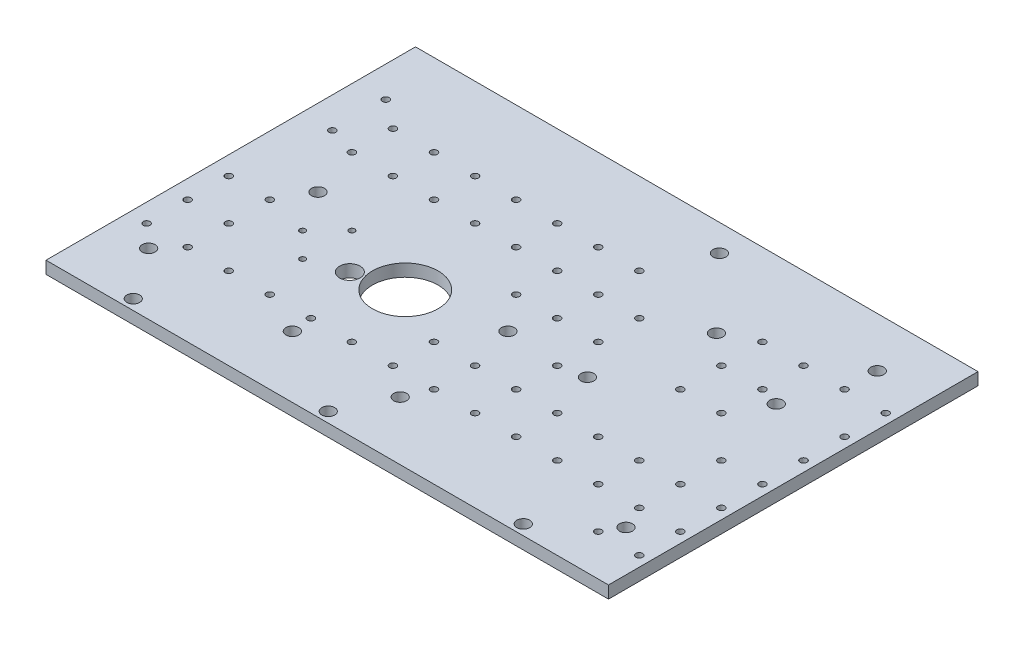
from build123d import *

# Parameters (mm, degrees)
SKETCH1_W           = 274
SKETCH1_H           = 180
SKETCH1_R           = 1.4
SKETCH1_R_2         = 16
SKETCH1_R_3         = 5
SKETCH1_R_4         = 3.15
SKETCH1_R_5         = 1.65
BOSS_EXTRUDE1_DEPTH = 6


with BuildPart() as part:
    # Sketch1 → Boss-Extrude1 (new body)
    with BuildSketch(Plane(origin=(0, 0, 0), x_dir=(1, 0, 0), z_dir=(0, 1, 0))):
        Rectangle(SKETCH1_W, SKETCH1_H)
        with Locations(Location((-75, -3, 0), (0, 0, 270))):
            Circle(SKETCH1_R, mode=Mode.SUBTRACT)
        with Locations(Location((-87, -15, 0), (0, 0, 270))):
            Circle(SKETCH1_R, mode=Mode.SUBTRACT)
        with Locations(Location((-75, -27, 0), (0, 0, 270))):
            Circle(SKETCH1_R, mode=Mode.SUBTRACT)
        with Locations(Location((-37, -15, 0), (0, 0, 270))):
            Circle(SKETCH1_R_2, mode=Mode.SUBTRACT)
        with Locations(Location((-58, -21, 0), (0, 0, 270))):
            Circle(SKETCH1_R_3, mode=Mode.SUBTRACT)
        with Locations(Location((-99.5, 5, 0), (0, 0, 270))):
            Circle(SKETCH1_R_4, mode=Mode.SUBTRACT)
        with Locations(Location((24.097224397, 76.923560319, 0), (0, 0, 270))):
            Circle(SKETCH1_R_4, mode=Mode.SUBTRACT)
        with Locations(Location((5.5, -7.5, 0), (0, 0, 270))):
            Circle(SKETCH1_R_4, mode=Mode.SUBTRACT)
        with Locations(Location((44.241196746, -7.5, 0), (0, 0, 270))):
            Circle(SKETCH1_R_4, mode=Mode.SUBTRACT)
        with Locations(Location((57.102540378, 42.5, 0), (0, 0, 270))):
            Circle(SKETCH1_R_4, mode=Mode.SUBTRACT)
        with Locations(Location((101.504885591, 27.217533736, 0), (0, 0, 270))):
            Circle(SKETCH1_R_4, mode=Mode.SUBTRACT)
        with Locations(Location((112.15381179, 65.773990664, 0), (0, 0, 270))):
            Circle(SKETCH1_R_4, mode=Mode.SUBTRACT)
        with Locations(Location((90.5, -85, 0), (0, 0, 270))):
            Circle(SKETCH1_R_4, mode=Mode.SUBTRACT)
        with Locations(Location((-4.5, -85, 0), (0, 0, 270))):
            Circle(SKETCH1_R_4, mode=Mode.SUBTRACT)
        with Locations(Location((-99.5, -85, 0), (0, 0, 270))):
            Circle(SKETCH1_R_4, mode=Mode.SUBTRACT)
        with Locations(Location((-122, 60.49863196, 0), (0, 0, 270))):
            Circle(SKETCH1_R_5, mode=Mode.SUBTRACT)
        with Locations(Location((-122, 34.50136804, 0), (0, 0, 270))):
            Circle(SKETCH1_R_5, mode=Mode.SUBTRACT)
        with Locations(Location((-117, -60, 0), (0, 0, 270))):
            Circle(SKETCH1_R_4, mode=Mode.SUBTRACT)
        with Locations(Location((-47, -60, 0), (0, 0, 270))):
            Circle(SKETCH1_R_4, mode=Mode.SUBTRACT)
        with Locations(Location((7, -61.482471058, 0), (0, 0, 270))):
            Circle(SKETCH1_R_4, mode=Mode.SUBTRACT)
        with Locations(Location((117, -61.482471058, 0), (0, 0, 270))):
            Circle(SKETCH1_R_4, mode=Mode.SUBTRACT)
        with Locations(Location((132, 50, 0), (0, 0, 270))):
            Circle(SKETCH1_R_5, mode=Mode.SUBTRACT)
        with Locations(Location((132, 30, 0), (0, 0, 270))):
            Circle(SKETCH1_R_5, mode=Mode.SUBTRACT)
        with Locations(Location((132, 10, 0), (0, 0, 270))):
            Circle(SKETCH1_R_5, mode=Mode.SUBTRACT)
        with Locations(Location((132, -10, 0), (0, 0, 270))):
            Circle(SKETCH1_R_5, mode=Mode.SUBTRACT)
        with Locations(Location((132, -30, 0), (0, 0, 270))):
            Circle(SKETCH1_R_5, mode=Mode.SUBTRACT)
        with Locations(Location((132, -50, 0), (0, 0, 270))):
            Circle(SKETCH1_R_5, mode=Mode.SUBTRACT)
        with Locations(Location((132, -70, 0), (0, 0, 270))):
            Circle(SKETCH1_R_5, mode=Mode.SUBTRACT)
        with Locations(Location((112, 50, 0), (0, 0, 270))):
            Circle(SKETCH1_R_5, mode=Mode.SUBTRACT)
        with Locations(Location((112, -10, 0), (0, 0, 270))):
            Circle(SKETCH1_R_5, mode=Mode.SUBTRACT)
        with Locations(Location((112, -30, 0), (0, 0, 270))):
            Circle(SKETCH1_R_5, mode=Mode.SUBTRACT)
        with Locations(Location((112, -50, 0), (0, 0, 270))):
            Circle(SKETCH1_R_5, mode=Mode.SUBTRACT)
        with Locations(Location((112, -70, 0), (0, 0, 270))):
            Circle(SKETCH1_R_5, mode=Mode.SUBTRACT)
        with Locations(Location((92, 50, 0), (0, 0, 270))):
            Circle(SKETCH1_R_5, mode=Mode.SUBTRACT)
        with Locations(Location((92, 30, 0), (0, 0, 270))):
            Circle(SKETCH1_R_5, mode=Mode.SUBTRACT)
        with Locations(Location((92, 10, 0), (0, 0, 270))):
            Circle(SKETCH1_R_5, mode=Mode.SUBTRACT)
        with Locations(Location((92, -30, 0), (0, 0, 270))):
            Circle(SKETCH1_R_5, mode=Mode.SUBTRACT)
        with Locations(Location((92, -50, 0), (0, 0, 270))):
            Circle(SKETCH1_R_5, mode=Mode.SUBTRACT)
        with Locations(Location((72, 50, 0), (0, 0, 270))):
            Circle(SKETCH1_R_5, mode=Mode.SUBTRACT)
        with Locations(Location((72, 30, 0), (0, 0, 270))):
            Circle(SKETCH1_R_5, mode=Mode.SUBTRACT)
        with Locations(Location((72, 10, 0), (0, 0, 270))):
            Circle(SKETCH1_R_5, mode=Mode.SUBTRACT)
        with Locations(Location((72, -30, 0), (0, 0, 270))):
            Circle(SKETCH1_R_5, mode=Mode.SUBTRACT)
        with Locations(Location((72, -50, 0), (0, 0, 270))):
            Circle(SKETCH1_R_5, mode=Mode.SUBTRACT)
        with Locations(Location((52, -30, 0), (0, 0, 270))):
            Circle(SKETCH1_R_5, mode=Mode.SUBTRACT)
        with Locations(Location((52, -50, 0), (0, 0, 270))):
            Circle(SKETCH1_R_5, mode=Mode.SUBTRACT)
        with Locations(Location((32, 30, 0), (0, 0, 270))):
            Circle(SKETCH1_R_5, mode=Mode.SUBTRACT)
        with Locations(Location((32, 10, 0), (0, 0, 270))):
            Circle(SKETCH1_R_5, mode=Mode.SUBTRACT)
        with Locations(Location((32, -10, 0), (0, 0, 270))):
            Circle(SKETCH1_R_5, mode=Mode.SUBTRACT)
        with Locations(Location((32, -30, 0), (0, 0, 270))):
            Circle(SKETCH1_R_5, mode=Mode.SUBTRACT)
        with Locations(Location((32, -50, 0), (0, 0, 270))):
            Circle(SKETCH1_R_5, mode=Mode.SUBTRACT)
        with Locations(Location((12, 50, 0), (0, 0, 270))):
            Circle(SKETCH1_R_5, mode=Mode.SUBTRACT)
        with Locations(Location((12, 30, 0), (0, 0, 270))):
            Circle(SKETCH1_R_5, mode=Mode.SUBTRACT)
        with Locations(Location((12, 10, 0), (0, 0, 270))):
            Circle(SKETCH1_R_5, mode=Mode.SUBTRACT)
        with Locations(Location((12, -30, 0), (0, 0, 270))):
            Circle(SKETCH1_R_5, mode=Mode.SUBTRACT)
        with Locations(Location((12, -50, 0), (0, 0, 270))):
            Circle(SKETCH1_R_5, mode=Mode.SUBTRACT)
        with Locations(Location((-8, 50, 0), (0, 0, 270))):
            Circle(SKETCH1_R_5, mode=Mode.SUBTRACT)
        with Locations(Location((-8, 30, 0), (0, 0, 270))):
            Circle(SKETCH1_R_5, mode=Mode.SUBTRACT)
        with Locations(Location((-8, 10, 0), (0, 0, 270))):
            Circle(SKETCH1_R_5, mode=Mode.SUBTRACT)
        with Locations(Location((-8, -30, 0), (0, 0, 270))):
            Circle(SKETCH1_R_5, mode=Mode.SUBTRACT)
        with Locations(Location((-8, -50, 0), (0, 0, 270))):
            Circle(SKETCH1_R_5, mode=Mode.SUBTRACT)
        with Locations(Location((-28, 50, 0), (0, 0, 270))):
            Circle(SKETCH1_R_5, mode=Mode.SUBTRACT)
        with Locations(Location((-28, 30, 0), (0, 0, 270))):
            Circle(SKETCH1_R_5, mode=Mode.SUBTRACT)
        with Locations(Location((-28, -50, 0), (0, 0, 270))):
            Circle(SKETCH1_R_5, mode=Mode.SUBTRACT)
        with Locations(Location((-48, 50, 0), (0, 0, 270))):
            Circle(SKETCH1_R_5, mode=Mode.SUBTRACT)
        with Locations(Location((-48, 30, 0), (0, 0, 270))):
            Circle(SKETCH1_R_5, mode=Mode.SUBTRACT)
        with Locations(Location((-48, -50, 0), (0, 0, 270))):
            Circle(SKETCH1_R_5, mode=Mode.SUBTRACT)
        with Locations(Location((-68, 50, 0), (0, 0, 270))):
            Circle(SKETCH1_R_5, mode=Mode.SUBTRACT)
        with Locations(Location((-68, 30, 0), (0, 0, 270))):
            Circle(SKETCH1_R_5, mode=Mode.SUBTRACT)
        with Locations(Location((-68, -50, 0), (0, 0, 270))):
            Circle(SKETCH1_R_5, mode=Mode.SUBTRACT)
        with Locations(Location((-88, 50, 0), (0, 0, 270))):
            Circle(SKETCH1_R_5, mode=Mode.SUBTRACT)
        with Locations(Location((-88, 30, 0), (0, 0, 270))):
            Circle(SKETCH1_R_5, mode=Mode.SUBTRACT)
        with Locations(Location((-88, -50, 0), (0, 0, 270))):
            Circle(SKETCH1_R_5, mode=Mode.SUBTRACT)
        with Locations(Location((-108, 50, 0), (0, 0, 270))):
            Circle(SKETCH1_R_5, mode=Mode.SUBTRACT)
        with Locations(Location((-108, 30, 0), (0, 0, 270))):
            Circle(SKETCH1_R_5, mode=Mode.SUBTRACT)
        with Locations(Location((-108, -10, 0), (0, 0, 270))):
            Circle(SKETCH1_R_5, mode=Mode.SUBTRACT)
        with Locations(Location((-108, -30, 0), (0, 0, 270))):
            Circle(SKETCH1_R_5, mode=Mode.SUBTRACT)
        with Locations(Location((-108, -50, 0), (0, 0, 270))):
            Circle(SKETCH1_R_5, mode=Mode.SUBTRACT)
        with Locations(Location((-128, -10, 0), (0, 0, 270))):
            Circle(SKETCH1_R_5, mode=Mode.SUBTRACT)
        with Locations(Location((-128, -30, 0), (0, 0, 270))):
            Circle(SKETCH1_R_5, mode=Mode.SUBTRACT)
        with Locations(Location((-128, -50, 0), (0, 0, 270))):
            Circle(SKETCH1_R_5, mode=Mode.SUBTRACT)
    extrude(amount=BOSS_EXTRUDE1_DEPTH)


solid = part.part
